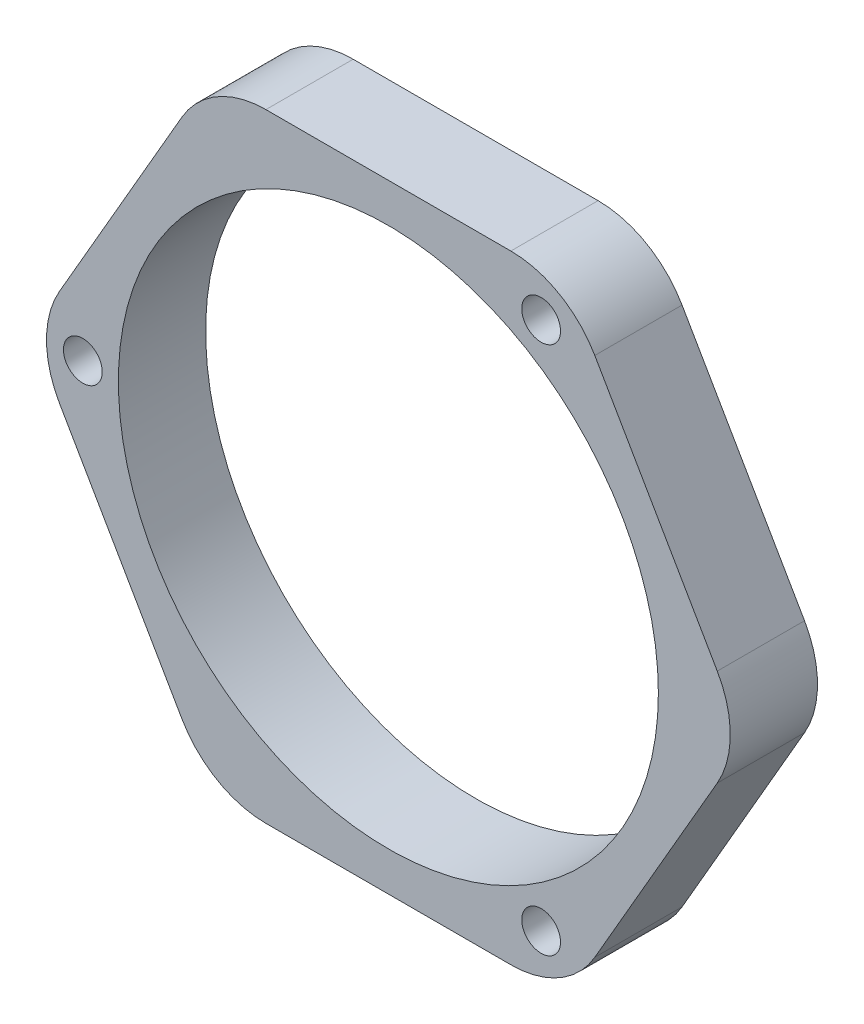
from build123d import *

# Parameters (mm, degrees)
SKETCH1_R           = 27.85
BOSS_EXTRUDE1_DEPTH = 9
FILLET1_R           = 10
SKETCH3_R           = 2
CUT_EXTRUDE1_DEPTH  = 49.383301757
CIRPATTERN1_COUNT   = 3


with BuildPart() as part:
    # Sketch1 → Boss-Extrude1 (new body)
    with BuildSketch(Plane.XY):
        Polygon((18.405926582, -31.88), (36.811853164, 0), (18.405926582, 31.88), (-18.405926582, 31.88), (-36.811853164, 0), (-18.405926582, -31.88), align=None)
        Circle(SKETCH1_R, mode=Mode.SUBTRACT)
    extrude(amount=BOSS_EXTRUDE1_DEPTH)

    # Fillet1
    fillet1_edges = [part.edges().sort_by_distance(p)[0] for p in [
        (-18.405926582, -31.88, 4.5),
        (-36.811853164, 0, 4.5),
        (-18.405926582, 31.88, 4.5),
        (18.405926582, 31.88, 4.5),
        (36.811853164, 0, 4.5),
        (18.405926582, -31.88, 4.5),
    ]]
    fillet(fillet1_edges, radius=FILLET1_R)

    # Sketch3 → Cut-Extrude1 (cut, through all)
    with BuildSketch(Plane.XY.offset(9)):
        with Locations((-31.51484778, 0)):
            Circle(SKETCH3_R)
    cut_extrude1 = extrude(amount=-CUT_EXTRUDE1_DEPTH, mode=Mode.SUBTRACT)

    # CirPattern1: Cut-Extrude1 ×3 about axis
    cirpattern1_axis = Axis((0, 0, 0), (0, 0, 1))
    for i in range(1, CIRPATTERN1_COUNT):
        add(cut_extrude1.rotate(cirpattern1_axis, i * 360 / CIRPATTERN1_COUNT), mode=Mode.SUBTRACT)


solid = part.part
